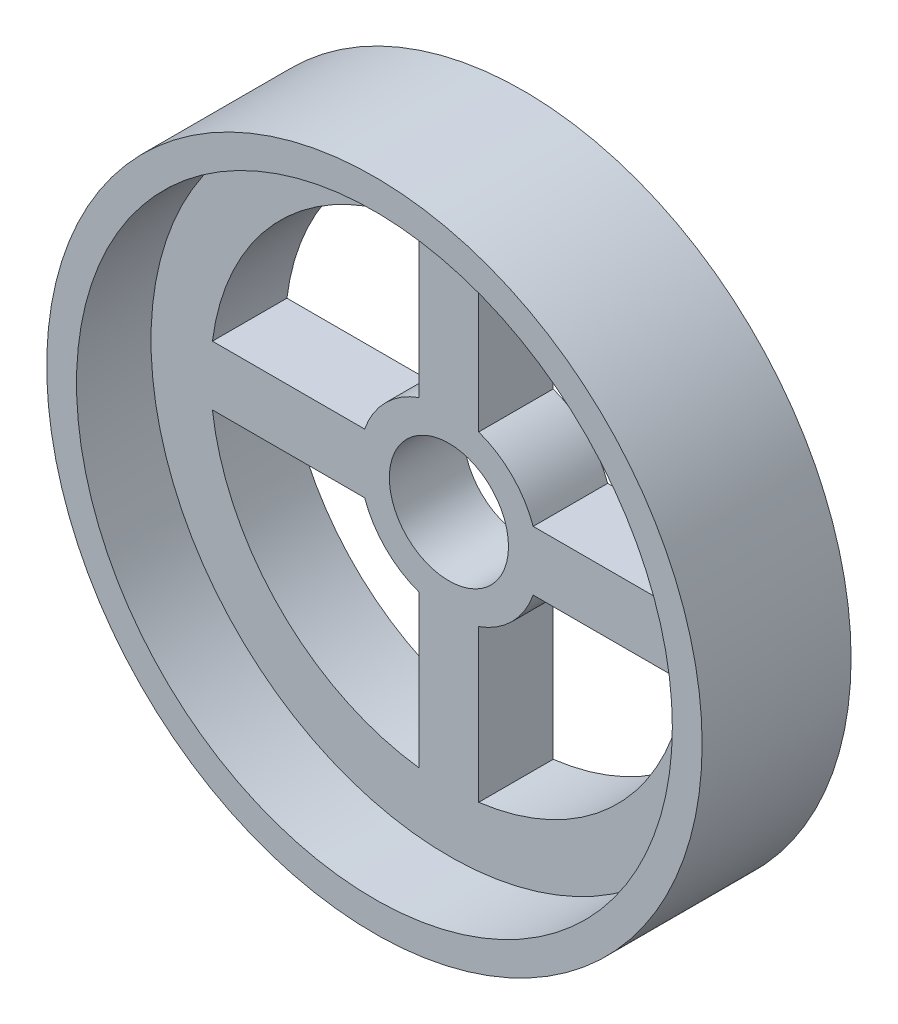
from build123d import *

# Parameters (mm, degrees)
ESBO_O1_R                = 20
ESBO_O1_R_2              = 4
RESSALTO_EXTRUS_O3_DEPTH = 5
ESBO_O1_6_R              = 22
ESBO_O1_6_R_2            = 20
RESSALTO_EXTRUS_O4_DEPTH = 10
ESBO_O1_7_R              = 4
RESSALTO_EXTRUS_O5_DEPTH = 2
ESBO_O2_R                = 16
CORTE_EXTRUS_O1_DEPTH    = 60
RESSALTO_EXTRUS_O6_START = 5
ESBO_O3_R                = 4
RESSALTO_EXTRUS_O6_DEPTH = 5


with BuildPart() as part:
    # Esboço1 → Ressalto-extrusão3 (new body)
    with BuildSketch(Plane.XY):
        Circle(ESBO_O1_R)
        Circle(ESBO_O1_R_2, mode=Mode.SUBTRACT)
    extrude(amount=RESSALTO_EXTRUS_O3_DEPTH)

    # Esboço1<6> → Ressalto-extrusão4 (add)
    with BuildSketch(Plane.XY):
        Circle(ESBO_O1_6_R)
        Circle(ESBO_O1_6_R_2, mode=Mode.SUBTRACT)
    extrude(amount=RESSALTO_EXTRUS_O4_DEPTH)

    # Esboço1<7> → Ressalto-extrusão5 (add)
    with BuildSketch(Plane.XY):
        Circle(ESBO_O1_7_R)
    extrude(amount=RESSALTO_EXTRUS_O5_DEPTH)

    # Esboço2 → Corte-extrusão1 (cut)
    with BuildSketch(Plane.XY.offset(5)):
        Circle(ESBO_O2_R)
    extrude(amount=-CORTE_EXTRUS_O1_DEPTH, mode=Mode.SUBTRACT)

    # Esboço3 → Ressalto-extrusão6 (add)
    with BuildSketch(Plane.XY.offset(RESSALTO_EXTRUS_O6_START)):
        with BuildLine():
            Line((2, -15.874507866), (2, -5.656854249))
            ThreePointArc((2, -5.656854249), (4.243647898, -4.241633237), (5.657803332, -1.997313561))
            Line((5.657803332, -1.997313561), (15.874846095, -1.997313561))
            ThreePointArc((15.874846095, -1.997313561), (16, 0), (15.874846095, 1.997313561))
            Line((15.874846095, 1.997313561), (5.657803332, 1.997313561))
            ThreePointArc((5.657803332, 1.997313561), (4.243647898, 4.241633237), (2, 5.656854249))
            Line((2, 5.656854249), (2, 15.874507866))
            ThreePointArc((2, 15.874507866), (0, 16), (-2, 15.874507866))
            Line((-2, 15.874507866), (-2, 5.656854249))
            ThreePointArc((-2, 5.656854249), (-4.243647898, 4.241633237), (-5.657803332, 1.997313561))
            Line((-5.657803332, 1.997313561), (-15.874846095, 1.997313561))
            ThreePointArc((-15.874846095, 1.997313561), (-16, 0), (-15.874846095, -1.997313561))
            Line((-15.874846095, -1.997313561), (-5.657803332, -1.997313561))
            ThreePointArc((-5.657803332, -1.997313561), (-4.243647898, -4.241633237), (-2, -5.656854249))
            Line((-2, -5.656854249), (-2, -15.874507866))
            ThreePointArc((-2, -15.874507866), (0, -16), (2, -15.874507866))
        make_face()
        Circle(ESBO_O3_R, mode=Mode.SUBTRACT)
    extrude(amount=-RESSALTO_EXTRUS_O6_DEPTH)


solid = part.part
